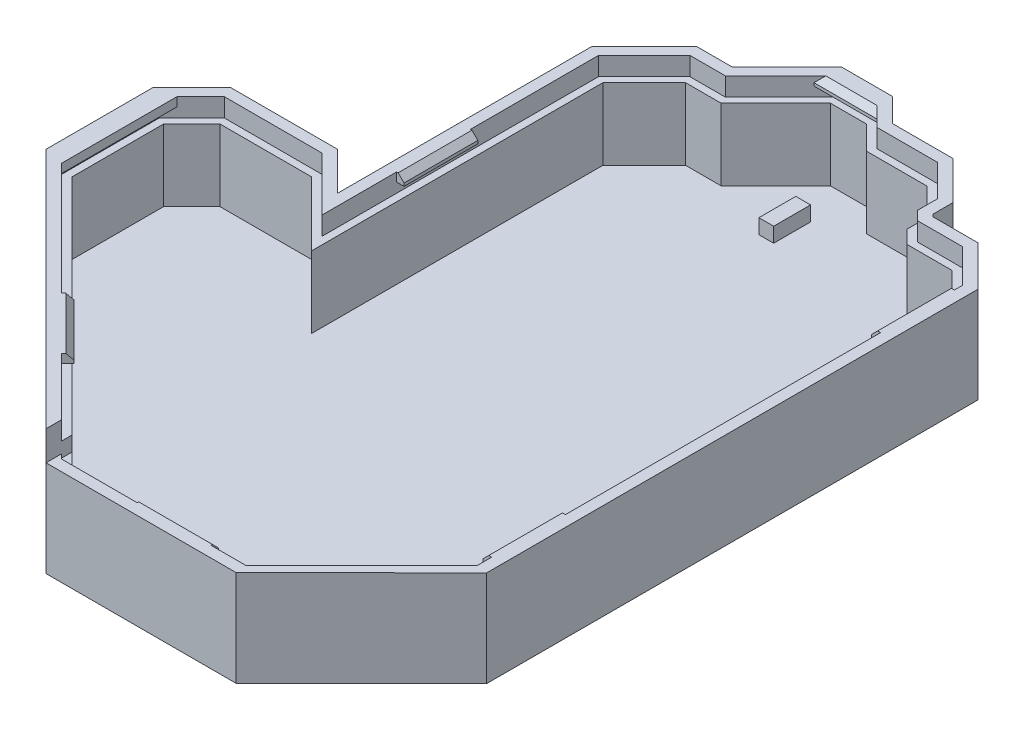
from build123d import *

# Parameters (mm, degrees)
ESBO_O1_W                = 100
ESBO_O1_H                = 120
RESSALTO_EXTRUS_O1_DEPTH = 13
CORTE_EXTRUS_O1_DEPTH    = 12.2
ESBO_O5_W                = 100
ESBO_O5_H                = 120
CORTE_EXTRUS_O2_DEPTH    = 24
CORTE_EXTRUS_O3_DEPTH    = 2.5
ESBO_O7_W                = 1
ESBO_O7_H                = 10
ESBO_O7_W_2              = 1.2
ESBO_O7_W_3              = 10
ESBO_O7_H_2              = 1
ESBO_O7_H_3              = 16.4405419
ESBO_O7_W_4              = 8.5960749
ESBO_O7_H_4              = 1.406812791
RESSALTO_EXTRUS_O2_DEPTH = 1.2
ESBO_O8_W                = 4
ESBO_O8_H                = 4.5
CORTE_EXTRUS_O4_DEPTH    = 10
ESBO_O9_W                = 2
ESBO_O9_H                = 5
RESSALTO_EXTRUS_O3_DEPTH = 2
CHANFRO1_SIZE            = 0.8


with BuildPart() as part:
    # Esboço1 → Ressalto-extrusão1 (new body)
    with BuildSketch(Plane(origin=(0, 0, 0), x_dir=(1, 0, 0), z_dir=(0, 1, 0))):
        with Locations((-3.939393939, -9.393939394)):
            Rectangle(ESBO_O1_W, ESBO_O1_H)
    extrude(amount=RESSALTO_EXTRUS_O1_DEPTH)

    # Esboço2 → Corte-extrusão1 (cut)
    with BuildSketch(Plane(origin=(0, 13, 0), x_dir=(1, 0, 0), z_dir=(0, 1, 0))):
        Polygon((31.508199898, -39.9190402), (31.508199898, 24.595030164), (27.530747921, 28.572482141), (21.431542719, 28.572482141), (19.652327636, 30.351697224), (19.652327636, 33.082043063), (15.960779613, 36.773591087), (7.746138477, 36.773591087), (4.559278928, 39.960450636), (-0.321107452, 39.960450636), (-7.730384523, 32.551173564), (-12.530246006, 32.551173564), (-18.145727819, 26.935691751), (-18.145727819, -12.538643207), (-26.839415482, -3.844955544), (-39.246127252, -3.844955544), (-43.063176727, -7.662005018), (-43.063176727, -20.068716788), (-7.730384523, -55.401508991), (15.960779613, -55.401508991), align=None)
    extrude(amount=-CORTE_EXTRUS_O1_DEPTH, mode=Mode.SUBTRACT)

    # Esboço5 → Corte-extrusão2 (cut)
    with BuildSketch(Plane(origin=(0, 13, 0), x_dir=(1, 0, 0), z_dir=(0, 1, 0))):
        with Locations((-3.939393939, -9.393939394)):
            Rectangle(ESBO_O5_W, ESBO_O5_H)
        Polygon((34.008199898, 16.264683084), (34.008199898, 25.63056407), (28.566281827, 31.072482141), (22.467076625, 31.072482141), (22.152327636, 31.38723113), (22.152327636, 34.117576969), (16.996313518, 39.273591087), (8.781672383, 39.273591087), (5.594812834, 42.460450636), (-1.356641358, 42.460450636), (-8.765918429, 35.051173564), (-13.565779912, 35.051173564), (-20.645727819, 27.971225657), (-20.645727819, -6.503109301), (-25.803881576, -1.344955544), (-40.281661158, -1.344955544), (-45.563176727, -6.626471112), (-45.563176727, -21.104250694), (-8.765918429, -57.901508991), (9.20558363, -57.901508991), (16.993249442, -57.901508991), (34.008199898, -40.95764084), align=None, mode=Mode.SUBTRACT)
    extrude(amount=-CORTE_EXTRUS_O2_DEPTH, mode=Mode.SUBTRACT)

    # Esboço6 → Corte-extrusão3 (cut)
    with BuildSketch(Plane(origin=(0, 13, 0), x_dir=(1, 0, 0), z_dir=(0, 1, 0))):
        Polygon((-26.42520192, -2.844955544), (-19.145727819, -10.124429645), (-19.145727819, 27.349905314), (-12.944459568, 33.551173564), (-8.144598086, 33.551173564), (-0.735321014, 40.960450636), (4.97349249, 40.960450636), (8.160352039, 37.773591087), (16.374993175, 37.773591087), (20.652327636, 33.496256625), (20.652327636, 30.765910786), (21.845756281, 29.572482141), (27.944961483, 29.572482141), (32.508199898, 25.009243726), (32.508199898, -40.708099195), (16.814790102, -56.401508991), (-8.144598086, -56.401508991), (-44.063176727, -20.48293035), (-44.063176727, -7.247791456), (-39.660340814, -2.844955544), align=None)
    extrude(amount=-CORTE_EXTRUS_O3_DEPTH, mode=Mode.SUBTRACT)

    # Esboço7 → Ressalto-extrusão2 (add)
    with BuildSketch(Plane(origin=(0, 13, 0), x_dir=(1, 0, 0), z_dir=(0, 1, 0))):
        with Locations((-18.645727819, 5)):
            Rectangle(ESBO_O7_W, ESBO_O7_H)
        with Locations((31.908199898, -33.775847323)):
            Rectangle(ESBO_O7_W_2, ESBO_O7_H)
        with Locations((31.908199898, 18.926155897)):
            Rectangle(ESBO_O7_W_2, ESBO_O7_H)
        with Locations((7.086788937, -55.901508991)):
            Rectangle(ESBO_O7_W_3, ESBO_O7_H_2)
        with Locations((-43.469924349, -13.990706428)):
            Rectangle(ESBO_O7_W_2, ESBO_O7_H_3)
        Polygon((-27.607092583, -36.939014494), (-20.536024771, -44.010082306), (-19.687496633, -43.161554169), (-26.758564445, -36.090486357), align=None)
        with Locations((2.082267831, 40.257044241)):
            Rectangle(ESBO_O7_W_4, ESBO_O7_H_4)
    extrude(amount=-RESSALTO_EXTRUS_O2_DEPTH)

    # Esboço8 → Corte-extrusão4 (cut)
    with BuildSketch(Plane.XY.offset(57.901508991)):
        with Locations((-10.765918429, 10.75)):
            Rectangle(ESBO_O8_W, ESBO_O8_H)
    extrude(amount=-CORTE_EXTRUS_O4_DEPTH, mode=Mode.SUBTRACT)

    # Esboço9 → Ressalto-extrusão3 (add)
    with BuildSketch(Plane(origin=(0, 0.8, 0), x_dir=(1, 0, 0), z_dir=(0, 1, 0))):
        with Locations((1.570718191, 31.875055196)):
            Rectangle(ESBO_O9_W, ESBO_O9_H)
    extrude(amount=RESSALTO_EXTRUS_O3_DEPTH)

    # Chanfro1
    chanfro1_edges = [part.edges().sort_by_distance(p)[0] for p in [
        (-18.145727819, 13, -5),
        (7.086788937, 13, 55.401508991),
        (31.308199898, 13, 33.775847323),
        (-23.223030539, 13, 39.626020263),
        (2.119085738, 13, -39.553637845),
        (31.308199898, 13, -18.926155897),
    ]]
    chamfer(chanfro1_edges, length=CHANFRO1_SIZE)


solid = part.part
